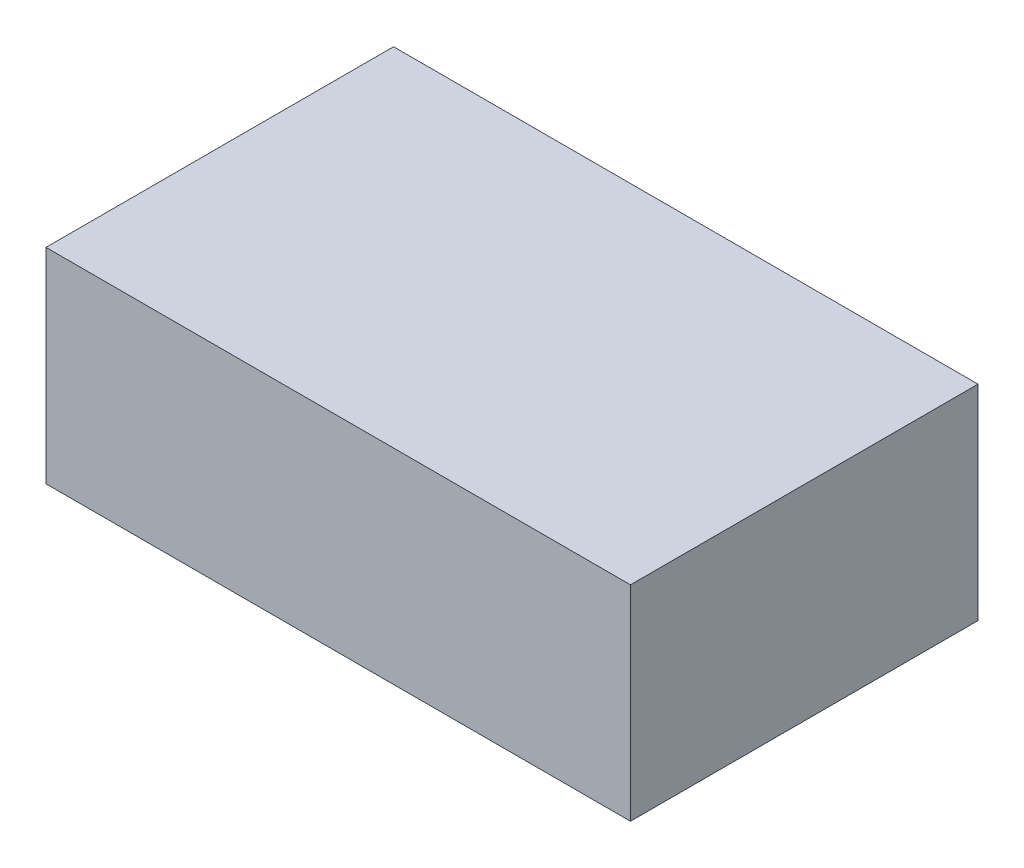
from build123d import *

# Parameters (mm, degrees)
SKETCH1_W               = 7.8199996
SKETCH1_H               = 2.7399996
COMPONENT_OUTLINE_DEPTH = 4.6500034


with BuildPart() as part:
    # Sketch1 → Component_Outline (new body)
    with BuildSketch(Plane.XY):
        with Locations((2.54, 0)):
            Rectangle(SKETCH1_W, SKETCH1_H)
    extrude(amount=COMPONENT_OUTLINE_DEPTH)


solid = part.part
